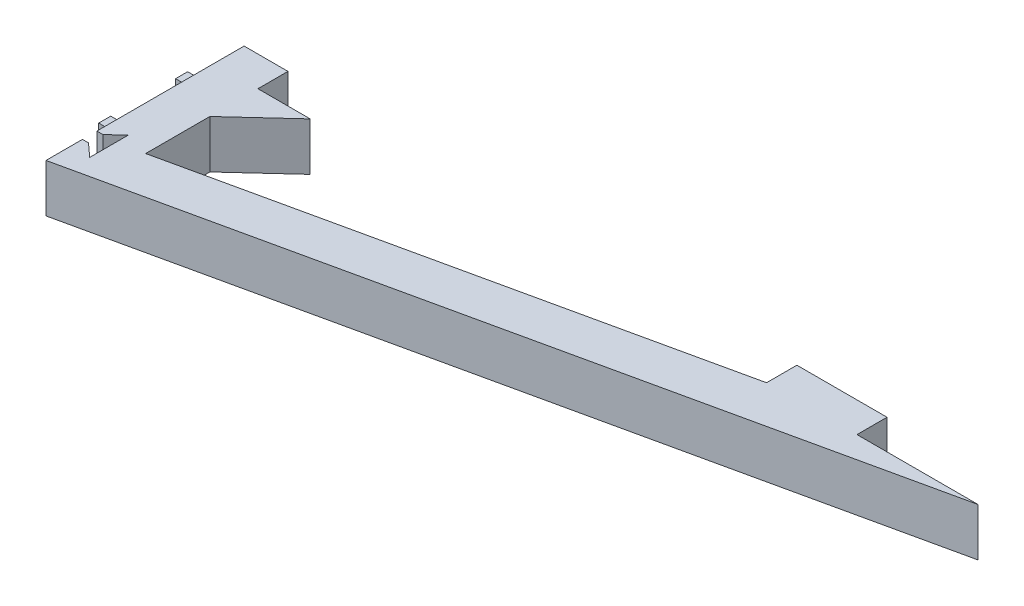
from build123d import *

# Parameters (mm, degrees)
P_IDAT_VYSUNUT_M1_DEPTH  = 8
ODEBRAT_VYSUNUT_M1_DEPTH = 132.589517946
SKICA3_W                 = 2
SKICA3_H                 = 2
P_IDAT_VYSUNUT_M2_DEPTH  = 4
SKICA5_W                 = 16
SKICA5_H                 = 8
P_IDAT_VYSUNUT_M4_DEPTH  = 8
ODEBRAT_VYSUNUT_M3_DEPTH = 132.589517946


with BuildPart() as part:
    # Skica1 → Přidat vysunutím1 (new body)
    with BuildSketch(Plane(origin=(0, 0, 0), x_dir=(1, 0, 0), z_dir=(0, 1, 0))):
        Polygon((0, 0), (0, -32.97), (127.140789416, -5), (107, -5), (107, 0), (92, 0), (92, -5.051361455), (7.3, -23.684712804), (7.3, 0), align=None)
    extrude(amount=P_IDAT_VYSUNUT_M1_DEPTH)

    # Skica2 → Odebrat vysunutím1 (cut, through all)
    with BuildSketch(Plane(origin=(0, 8, 0), x_dir=(1, 0, 0), z_dir=(0, 1, 0))):
        Polygon((0, -24.5), (1, -24.5), (3.2, -22.5), (3.2, -28.9), (1, -26.9), (0, -26.9), align=None)
    extrude(amount=-ODEBRAT_VYSUNUT_M1_DEPTH, mode=Mode.SUBTRACT)

    # Skica3 → Přidat vysunutím2 (add)
    with BuildSketch(Plane.ZY):
        with Locations((6.4, 4)):
            Rectangle(SKICA3_W, SKICA3_H)
        with Locations((19.2, 4)):
            Rectangle(SKICA3_W, SKICA3_H)
    extrude(amount=P_IDAT_VYSUNUT_M2_DEPTH)

    # Skica5 → Přidat vysunutím4 (add)
    with BuildSketch(Plane(origin=(0, 8, 0), x_dir=(1, 0, 0), z_dir=(0, 1, 0))):
        with Locations((8, -9)):
            Rectangle(SKICA5_W, SKICA5_H)
    extrude(amount=-P_IDAT_VYSUNUT_M4_DEPTH)

    # Skica7 → Odebrat vysunutím3 (cut, through all)
    with BuildSketch(Plane.XZ):
        Polygon((7.3, 13), (16, 13), (16, 5), align=None)
    extrude(amount=-ODEBRAT_VYSUNUT_M3_DEPTH, mode=Mode.SUBTRACT)


solid = part.part
